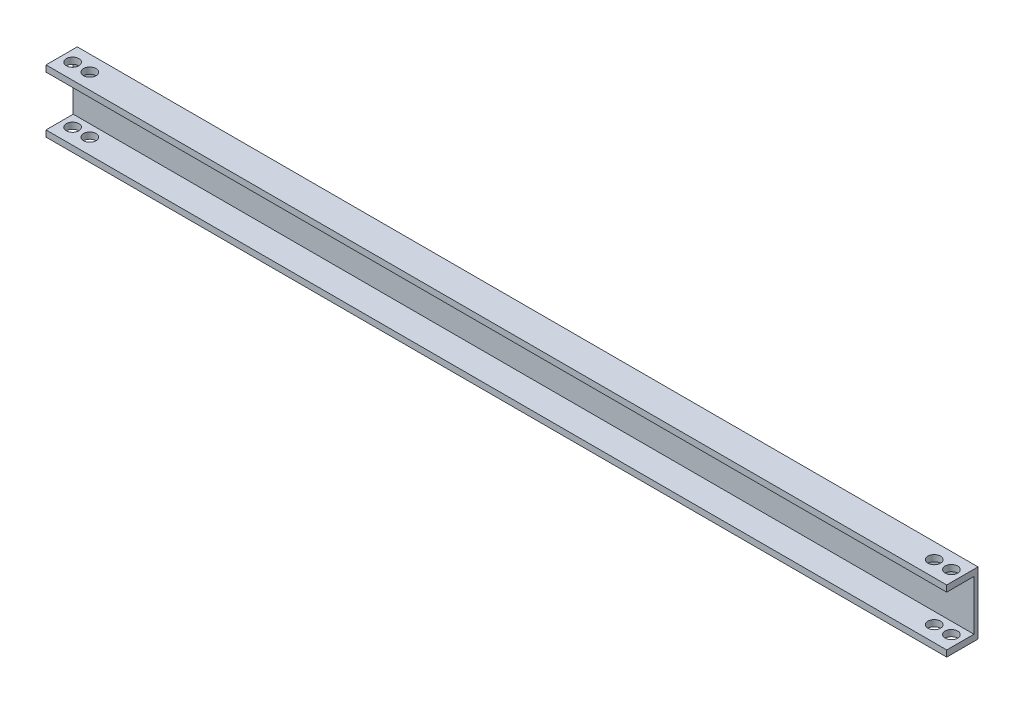
from build123d import *

# Parameters (mm, degrees)
SKETCH1_W           = 731.52
SKETCH1_H           = 25.4
BOSS_EXTRUDE1_DEPTH = 50.8
SKETCH2_R           = 5.08
CUT_EXTRUDE1_DEPTH  = 53.34
SKETCH5_W           = 731.52
SKETCH5_H           = 40.64
CUT_EXTRUDE4_DEPTH  = 22.098


with BuildPart() as part:
    # Sketch1 → Boss-Extrude1 (new body)
    with BuildSketch(Plane(origin=(0, 0, 0), x_dir=(1, 0, 0), z_dir=(0, 1, 0))):
        with Locations((365.76, 12.7)):
            Rectangle(SKETCH1_W, SKETCH1_H)
    extrude(amount=BOSS_EXTRUDE1_DEPTH)

    # Sketch2 → Cut-Extrude1 (cut)
    with BuildSketch(Plane(origin=(0, 50.8, 0), x_dir=(1, 0, 0), z_dir=(0, 1, 0))):
        with Locations(Location((8.89, 12.7, 0), (0, 0, 270))):
            Circle(SKETCH2_R)
        with Locations(Location((22.86, 12.7, 0), (0, 0, 270))):
            Circle(SKETCH2_R)
        with Locations(Location((722.63, 12.7, 0), (0, 0, 270))):
            Circle(SKETCH2_R)
        with Locations(Location((708.66, 12.7, 0), (0, 0, 270))):
            Circle(SKETCH2_R)
    extrude(amount=-CUT_EXTRUDE1_DEPTH, mode=Mode.SUBTRACT)

    # Sketch5 → Cut-Extrude4 (cut)
    with BuildSketch(Plane.XY):
        with Locations((365.76, 25.4)):
            Rectangle(SKETCH5_W, SKETCH5_H)
    extrude(amount=-CUT_EXTRUDE4_DEPTH, mode=Mode.SUBTRACT)


solid = part.part
